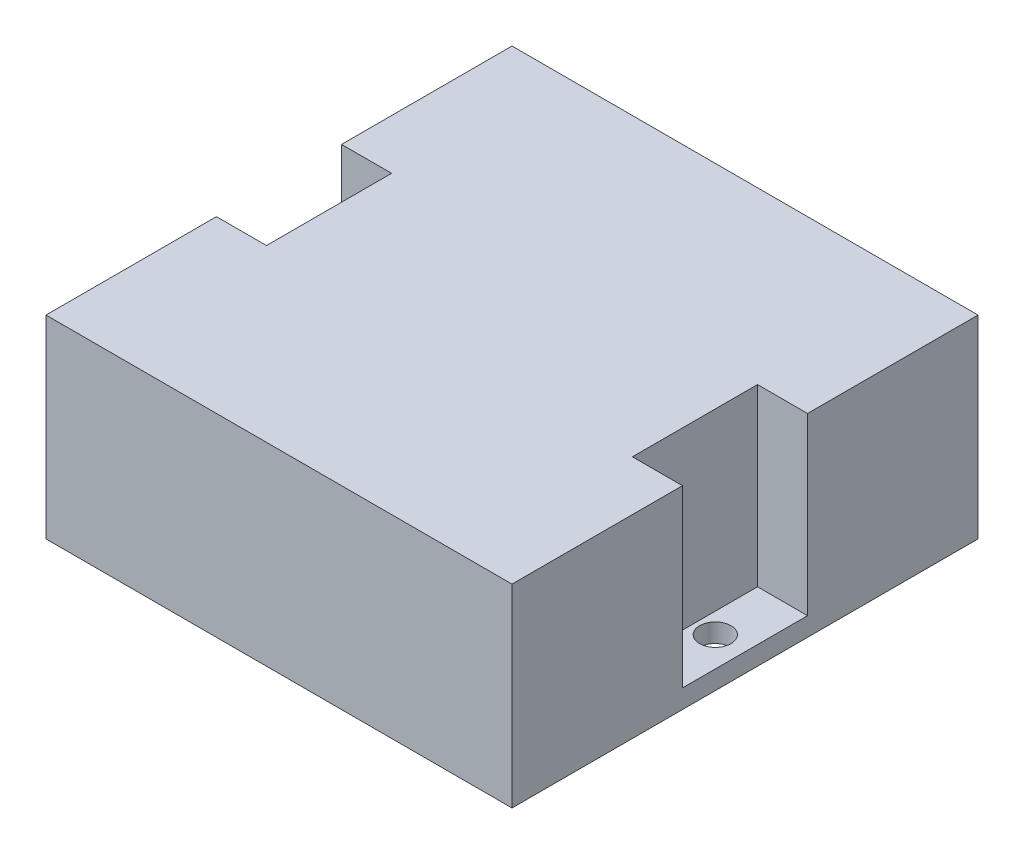
from build123d import *

# Parameters (mm, degrees)
SKETCH_1_W          = 74.5
SKETCH_1_H          = 74.5
EXTRUDE_1_DEPTH     = 31
SKETCH_2_W          = 8
SKETCH_2_H          = 20
CUT_EXTRUDE_1_DEPTH = 28
SKETCH_3_R          = 2.5
CUT_EXTRUDE_2_DEPTH = 60.658402593


with BuildPart() as part:
    # 草图1 → 凸台-拉伸1 (new body)
    with BuildSketch(Plane(origin=(0, 0, 0), x_dir=(1, 0, 0), z_dir=(0, 1, 0))):
        Rectangle(SKETCH_1_W, SKETCH_1_H)
    extrude(amount=EXTRUDE_1_DEPTH)

    # 草图2 → 切除-拉伸1 (cut)
    with BuildSketch(Plane(origin=(0, 31, 0), x_dir=(1, 0, 0), z_dir=(0, 1, 0))):
        with Locations((-33.25, 0)):
            Rectangle(SKETCH_2_W, SKETCH_2_H)
        with Locations((33.25, 0)):
            Rectangle(SKETCH_2_W, SKETCH_2_H)
    extrude(amount=-CUT_EXTRUDE_1_DEPTH, mode=Mode.SUBTRACT)

    # 草图3 → 切除-拉伸2 (cut, through all)
    with BuildSketch(Plane(origin=(0, 3, 0), x_dir=(1, 0, 0), z_dir=(0, 1, 0))):
        with Locations(Location((-32.5, 0, 0), (0, 0, 270))):
            Circle(SKETCH_3_R)
        with Locations(Location((32.5, 0, 0), (0, 0, 270))):
            Circle(SKETCH_3_R)
    extrude(amount=-CUT_EXTRUDE_2_DEPTH, mode=Mode.SUBTRACT)


solid = part.part
